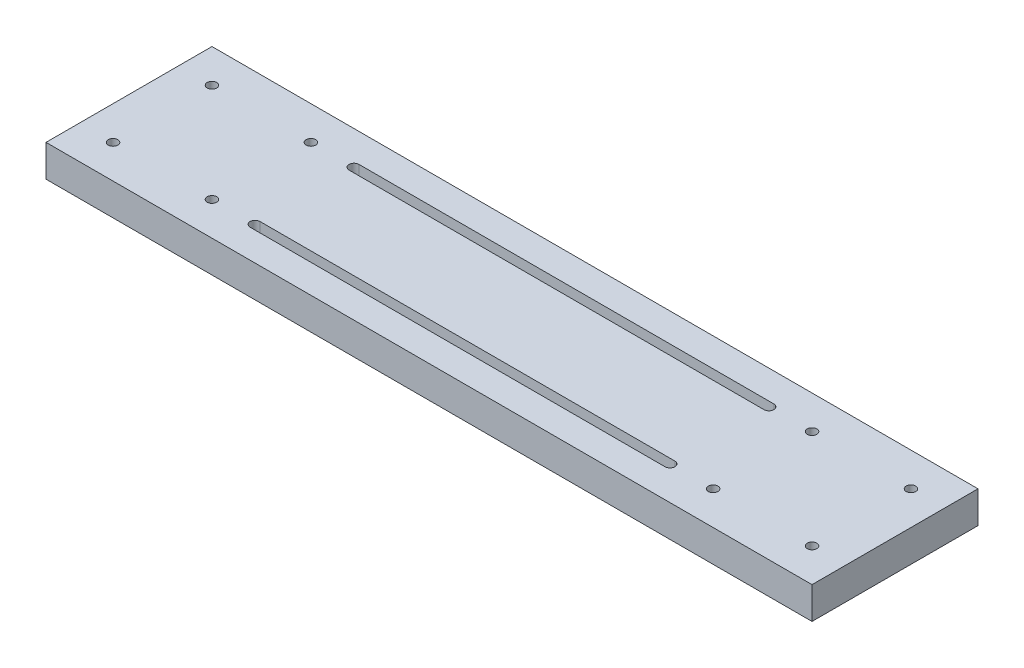
from build123d import *

# Parameters (mm, degrees)
SKETCH_12_W         = 240
SKETCH_12_H         = 52
EXTRUDE_1_DEPTH     = 10
CUT_EXTRUDE_4_REACH = 125.191
SKETCH_11_R         = 1.5


with BuildPart() as part:
    # 草图12 → 凸台-拉伸1 (new body)
    with BuildSketch(Plane(origin=(0, 0, 0), x_dir=(1, 0, 0), z_dir=(0, 1, 0))):
        Rectangle(SKETCH_12_W, SKETCH_12_H)
    extrude(amount=EXTRUDE_1_DEPTH)

    # 草图11 → 切除-拉伸4 (cut, up to next)
    with BuildSketch(Plane(origin=(0, 0, 0), x_dir=(1, 0, 0), z_dir=(0, 1, 0)), mode=Mode.PRIVATE) as cut_extrude_4_sk1:
        with Locations(Location((-109.5, 15.5, 0), (0, 0, 270))):
            Circle(SKETCH_11_R)
    cut_extrude_4_tool1 = extrude(cut_extrude_4_sk1.sketch, amount=CUT_EXTRUDE_4_REACH, mode=Mode.PRIVATE) & part.part
    # 草图11 → 切除-拉伸4 (cut, up to next)
    with BuildSketch(Plane(origin=(0, 0, 0), x_dir=(1, 0, 0), z_dir=(0, 1, 0)), mode=Mode.PRIVATE) as cut_extrude_4_sk2:
        with Locations(Location((-78.5, 15.5, 0), (0, 0, 270))):
            Circle(SKETCH_11_R)
    cut_extrude_4_tool2 = extrude(cut_extrude_4_sk2.sketch, amount=CUT_EXTRUDE_4_REACH, mode=Mode.PRIVATE) & part.part
    # 草图11 → 切除-拉伸4 (cut, up to next)
    with BuildSketch(Plane(origin=(0, 0, 0), x_dir=(1, 0, 0), z_dir=(0, 1, 0)), mode=Mode.PRIVATE) as cut_extrude_4_sk3:
        with Locations(Location((-109.5, -15.5, 0), (0, 0, 270))):
            Circle(SKETCH_11_R)
    cut_extrude_4_tool3 = extrude(cut_extrude_4_sk3.sketch, amount=CUT_EXTRUDE_4_REACH, mode=Mode.PRIVATE) & part.part
    # 草图11 → 切除-拉伸4 (cut, up to next)
    with BuildSketch(Plane(origin=(0, 0, 0), x_dir=(1, 0, 0), z_dir=(0, 1, 0)), mode=Mode.PRIVATE) as cut_extrude_4_sk4:
        with Locations(Location((-78.5, -15.5, 0), (0, 0, 270))):
            Circle(SKETCH_11_R)
    cut_extrude_4_tool4 = extrude(cut_extrude_4_sk4.sketch, amount=CUT_EXTRUDE_4_REACH, mode=Mode.PRIVATE) & part.part
    # 草图11 → 切除-拉伸4 (cut, up to next)
    with BuildSketch(Plane(origin=(0, 0, 0), x_dir=(1, 0, 0), z_dir=(0, 1, 0)), mode=Mode.PRIVATE) as cut_extrude_4_sk5:
        with Locations(Location((78.5, 15.5, 0), (0, 0, 270))):
            Circle(SKETCH_11_R)
    cut_extrude_4_tool5 = extrude(cut_extrude_4_sk5.sketch, amount=CUT_EXTRUDE_4_REACH, mode=Mode.PRIVATE) & part.part
    # 草图11 → 切除-拉伸4 (cut, up to next)
    with BuildSketch(Plane(origin=(0, 0, 0), x_dir=(1, 0, 0), z_dir=(0, 1, 0)), mode=Mode.PRIVATE) as cut_extrude_4_sk6:
        with Locations(Location((109.5, 15.5, 0), (0, 0, 270))):
            Circle(SKETCH_11_R)
    cut_extrude_4_tool6 = extrude(cut_extrude_4_sk6.sketch, amount=CUT_EXTRUDE_4_REACH, mode=Mode.PRIVATE) & part.part
    # 草图11 → 切除-拉伸4 (cut, up to next)
    with BuildSketch(Plane(origin=(0, 0, 0), x_dir=(1, 0, 0), z_dir=(0, 1, 0)), mode=Mode.PRIVATE) as cut_extrude_4_sk7:
        with Locations(Location((109.5, -15.5, 0), (0, 0, 270))):
            Circle(SKETCH_11_R)
    cut_extrude_4_tool7 = extrude(cut_extrude_4_sk7.sketch, amount=CUT_EXTRUDE_4_REACH, mode=Mode.PRIVATE) & part.part
    # 草图11 → 切除-拉伸4 (cut, up to next)
    with BuildSketch(Plane(origin=(0, 0, 0), x_dir=(1, 0, 0), z_dir=(0, 1, 0)), mode=Mode.PRIVATE) as cut_extrude_4_sk8:
        with Locations(Location((78.5, -15.5, 0), (0, 0, 270))):
            Circle(SKETCH_11_R)
    cut_extrude_4_tool8 = extrude(cut_extrude_4_sk8.sketch, amount=CUT_EXTRUDE_4_REACH, mode=Mode.PRIVATE) & part.part
    # 草图11 → 切除-拉伸4 (cut, up to next)
    with BuildSketch(Plane(origin=(0, 0, 0), x_dir=(1, 0, 0), z_dir=(0, 1, 0)), mode=Mode.PRIVATE) as cut_extrude_4_sk9:
        with BuildLine():
            Line((-65, 17.05), (65, 17.05))
            ThreePointArc((65, 17.05), (66.55, 15.5), (65, 13.95))
            Line((65, 13.95), (-65, 13.95))
            ThreePointArc((-65, 13.95), (-66.55, 15.5), (-65, 17.05))
        make_face()
    cut_extrude_4_tool9 = extrude(cut_extrude_4_sk9.sketch, amount=CUT_EXTRUDE_4_REACH, mode=Mode.PRIVATE) & part.part
    # 草图11 → 切除-拉伸4 (cut, up to next)
    with BuildSketch(Plane(origin=(0, 0, 0), x_dir=(1, 0, 0), z_dir=(0, 1, 0)), mode=Mode.PRIVATE) as cut_extrude_4_sk10:
        with BuildLine():
            Line((-65, -13.95), (65, -13.95))
            ThreePointArc((65, -13.95), (66.55, -15.5), (65, -17.05))
            Line((65, -17.05), (-65, -17.05))
            ThreePointArc((-65, -17.05), (-66.55, -15.5), (-65, -13.95))
        make_face()
    cut_extrude_4_tool10 = extrude(cut_extrude_4_sk10.sketch, amount=CUT_EXTRUDE_4_REACH, mode=Mode.PRIVATE) & part.part
    add(cut_extrude_4_tool1.solids().sort_by_distance((-109.5, 0, -15.5))[0], mode=Mode.SUBTRACT)
    add(cut_extrude_4_tool2.solids().sort_by_distance((-78.5, 0, -15.5))[0], mode=Mode.SUBTRACT)
    add(cut_extrude_4_tool3.solids().sort_by_distance((-109.5, 0, 15.5))[0], mode=Mode.SUBTRACT)
    add(cut_extrude_4_tool4.solids().sort_by_distance((-78.5, 0, 15.5))[0], mode=Mode.SUBTRACT)
    add(cut_extrude_4_tool5.solids().sort_by_distance((78.5, 0, -15.5))[0], mode=Mode.SUBTRACT)
    add(cut_extrude_4_tool6.solids().sort_by_distance((109.5, 0, -15.5))[0], mode=Mode.SUBTRACT)
    add(cut_extrude_4_tool7.solids().sort_by_distance((109.5, 0, 15.5))[0], mode=Mode.SUBTRACT)
    add(cut_extrude_4_tool8.solids().sort_by_distance((78.5, 0, 15.5))[0], mode=Mode.SUBTRACT)
    add(cut_extrude_4_tool9.solids().sort_by_distance((0, 0, -15.5))[0], mode=Mode.SUBTRACT)
    add(cut_extrude_4_tool10.solids().sort_by_distance((0, 0, 15.5))[0], mode=Mode.SUBTRACT)


solid = part.part
